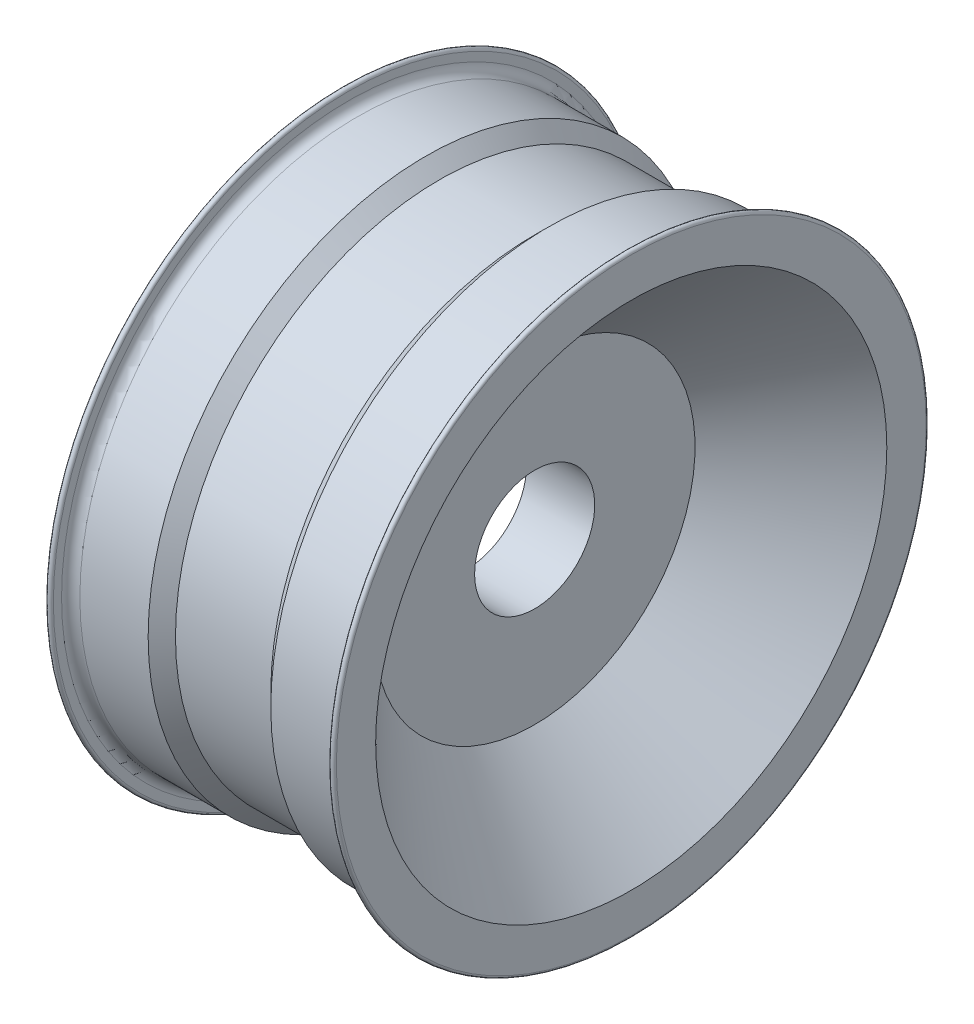
from build123d import *

# Parameters (mm, degrees)
SKETCH3_R           = 60
SKETCH3_R_2         = 43.979261671
BOSS_EXTRUDE1_DEPTH = 15
SKETCH4_R           = 43.979261671
CUT_EXTRUDE1_DEPTH  = 326.748645565


with BuildPart() as part:
    # Sketch1 → Revolve1 (revolve)
    with BuildSketch(Plane.XY, mode=Mode.PRIVATE) as revolve1_sk:
        with BuildLine():
            Line((0, 0), (34.9, 0))
            Line((34.9, 0), (34.9, 117.431960932))
            Line((34.9, 117.431960932), (105.6, 187.132561735))
            Line((105.6, 187.132561735), (105.6, 215.9))
            ThreePointArc((105.6, 215.9), (103.6, 217.9), (101.6, 215.9))
            Line((101.6, 215.9), (101.6, 209.9))
            ThreePointArc((101.6, 209.9), (99.637615434, 205.162384566), (94.9, 203.2))
            Line((94.9, 203.2), (44.9, 203.2))
            Line((44.9, 203.2), (34.9, 193.2))
            Line((34.9, 193.2), (-34.9, 193.2))
            Line((-34.9, 193.2), (-44.9, 203.2))
            Line((-44.9, 203.2), (-94.9, 203.2))
            ThreePointArc((-94.9, 203.2), (-99.637615434, 205.162384566), (-101.6, 209.9))
            Line((-101.6, 209.9), (-101.6, 215.9))
            ThreePointArc((-101.6, 215.9), (-103.6, 217.9), (-105.6, 215.9))
            Line((-105.6, 215.9), (-105.6, 188.494969013))
            Line((-105.6, 188.494969013), (0, 117.431960932))
            Line((0, 117.431960932), (0, 0))
        make_face()
    revolve(revolve1_sk.sketch.rotate(Axis((0, 0, 0), (1, 0, 0)), 90), axis=Axis((0, 0, 0), (1, 0, 0)))

    # Sketch3 → Boss-Extrude1 (add)
    with BuildSketch(Plane.ZY):
        Circle(SKETCH3_R)
        Circle(SKETCH3_R_2, mode=Mode.SUBTRACT)
    extrude(amount=BOSS_EXTRUDE1_DEPTH)

    # Sketch4 → Cut-Extrude1 (cut, through all)
    with BuildSketch(Plane.ZY):
        Circle(SKETCH4_R)
    extrude(amount=-CUT_EXTRUDE1_DEPTH, mode=Mode.SUBTRACT)


solid = part.part
